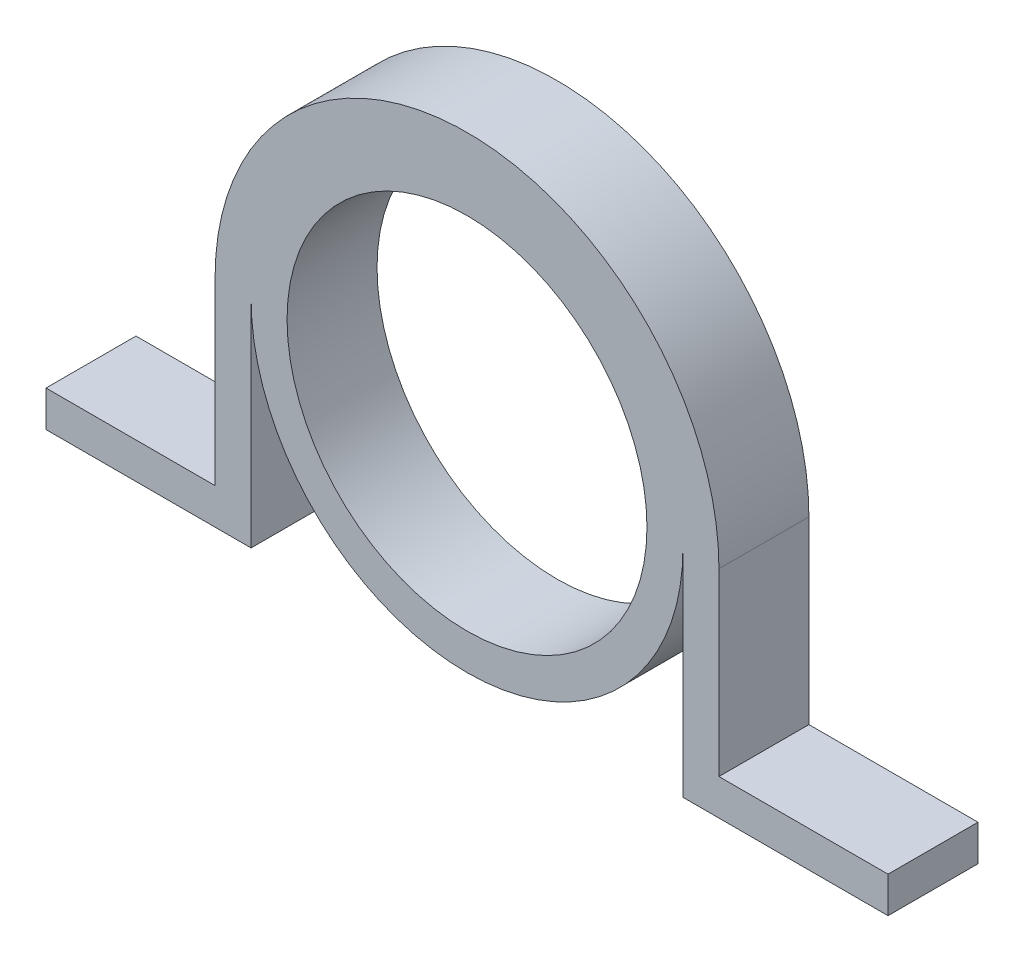
from build123d import *

# Parameters (mm, degrees)
SKETCH1_R           = 12
SKETCH1_R_2         = 10
BOSS_EXTRUDE1_DEPTH = 5


with BuildPart() as part:
    # Sketch1 → Boss-Extrude1 (new body)
    # profile 1 of 2: a face of its own
    with BuildSketch(Plane.XY):
        with BuildLine():
            Line((-12, -12), (-12, 0))
            ThreePointArc((-12, 0), (0, 12), (12, 0))
            Line((12, 0), (12, -12))
            Line((12, -12), (23.395271001, -12))
            Line((23.395271001, -12), (23.395271001, -10))
            Line((23.395271001, -10), (14, -10))
            Line((14, -10), (14, 0))
            ThreePointArc((14, 0), (0, 14), (-14, 0))
            Line((-14, 0), (-14, -10))
            Line((-14, -10), (-23.395271001, -10))
            Line((-23.395271001, -10), (-23.395271001, -12))
            Line((-23.395271001, -12), (-12, -12))
        make_face()
    # profile 2 of 2: a face of its own
    with BuildSketch(Plane.XY):
        Circle(SKETCH1_R)
        Circle(SKETCH1_R_2, mode=Mode.SUBTRACT)
    extrude(amount=BOSS_EXTRUDE1_DEPTH)


solid = part.part
